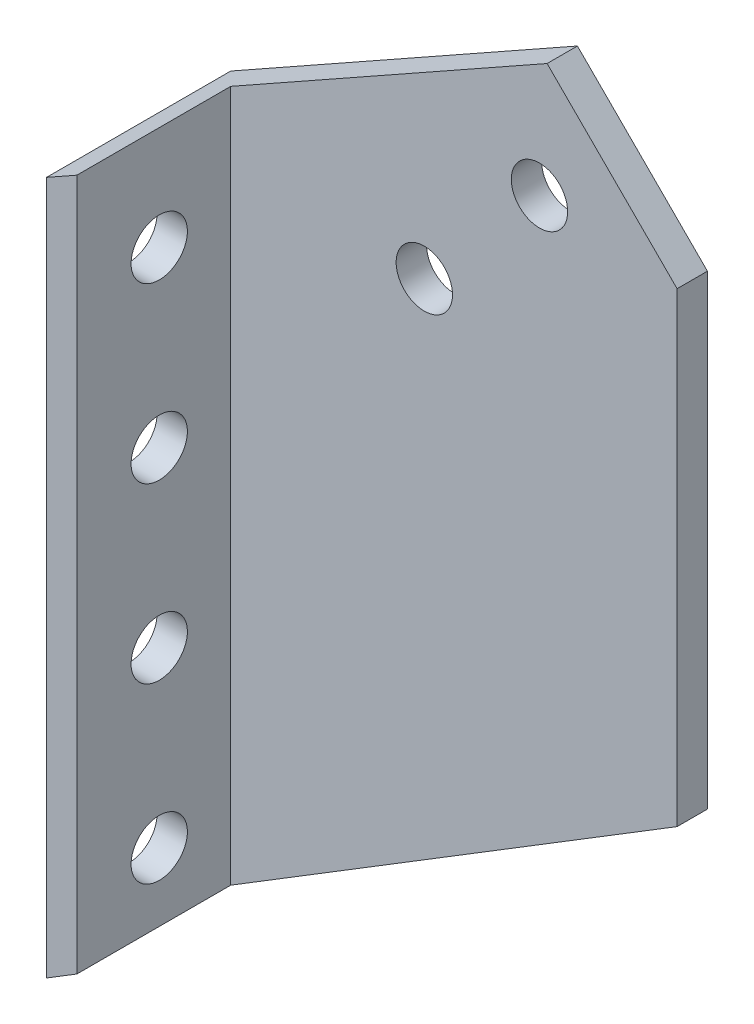
from build123d import *

# Parameters (mm, degrees)
SKETCH_1_R             = 13
EXTRUDE_1_DEPTH        = 14
EXTRUDE_2_DEPTH        = 71
SKETCH_5_R             = 13
CUT_EXTRUDE_3_DEPTH    = 420.252591423
PATTERN_LINEAR_1_COUNT = 4
PATTERN_LINEAR_1_PITCH = 80


with BuildPart() as part:
    # 草图1 → 凸台-拉伸1 (new body)
    with BuildSketch(Plane.XY):
        Polygon((-119.656440364, -63.376666372), (-119.656440364, 256.623333628), (40.343559636, 346.623333628), (100.343559636, 286.623333628), (100.343559636, 71.623333628), align=None)
        with Locations((-16.318215015, 232.316337145)):
            Circle(SKETCH_1_R, mode=Mode.SUBTRACT)
        with Locations((36.830892091, 292.109082639)):
            Circle(SKETCH_1_R, mode=Mode.SUBTRACT)
    extrude(amount=EXTRUDE_1_DEPTH)

    # 草图3 → 凸台-拉伸2 (add)
    with BuildSketch(Plane.XY.offset(14)):
        Polygon((-105.656440364, 264.498333628), (-105.656440364, -54.785757281), (-119.656440364, -63.376666372), (-119.656440364, 256.623333628), align=None)
    extrude(amount=EXTRUDE_2_DEPTH)

    # 草图5 → 切除-拉伸3 (cut, through all)
    with BuildSketch(Plane.ZY.offset(119.656440364)):
        with Locations(Location((47, 216.623333628, 0), (0, 0, 270))):
            Circle(SKETCH_5_R)
    cut_extrude_3 = extrude(amount=-CUT_EXTRUDE_3_DEPTH, mode=Mode.SUBTRACT)

    # 阵列(线性)1: 切除-拉伸3 ×4
    with Locations(*[(0, -i * PATTERN_LINEAR_1_PITCH, 0) for i in range(1, PATTERN_LINEAR_1_COUNT)]):
        add(cut_extrude_3, mode=Mode.SUBTRACT)


solid = part.part
